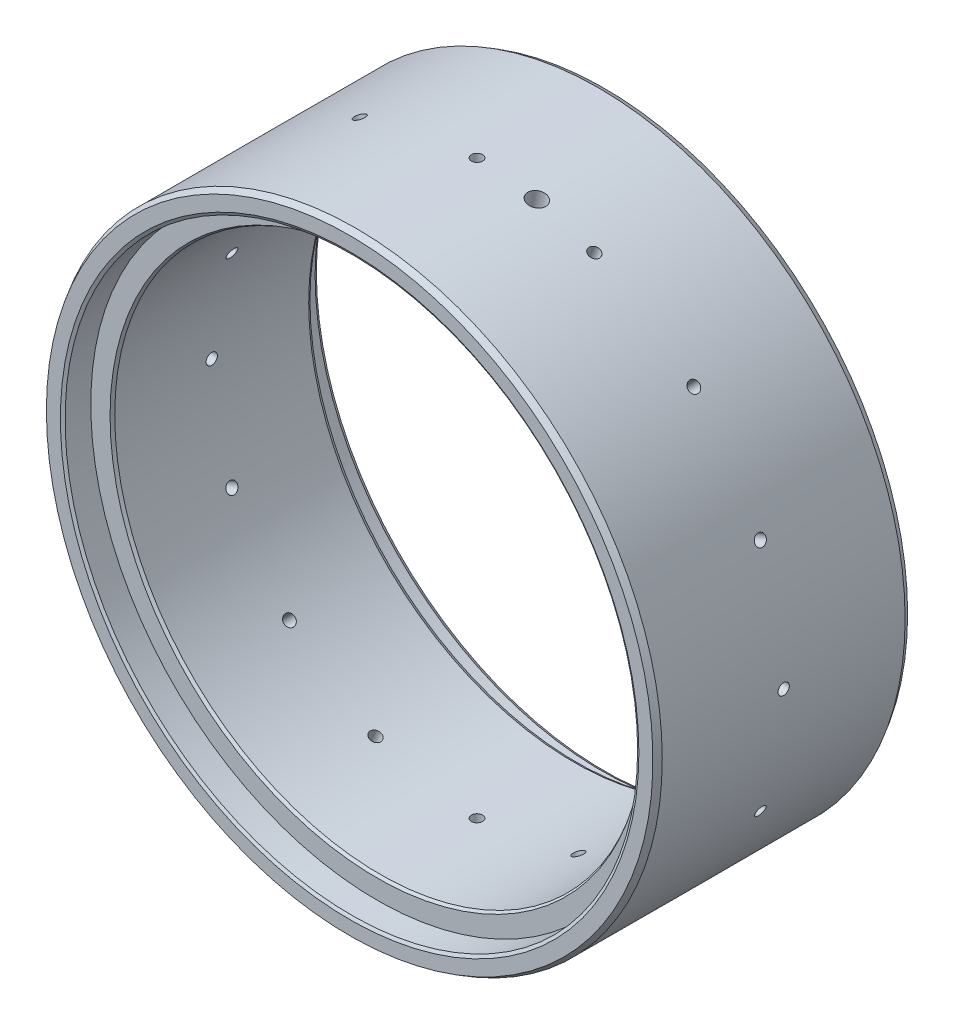
from build123d import *
from OCP.BRepFilletAPI import BRepFilletAPI_MakeChamfer

# Parameters (mm, degrees)
SKETCH1_R                  = 68.199
SKETCH1_R_2                = 58.9915
EXTRUDE1_DEPTH             = 28.321
SKETCH11_R                 = 63.66002
EXTRUDE2_DEPTH             = 6.096
CIRPATTERN1_COUNT          = 16
CHAMFER1_SIZE              = 0.381
CHAMFER1_SIZE2             = 0.659911358
CHAMFER3_SIZE              = 0.762
CHAMFER3_SIZE2             = 1.319822715
F_10_32_TAPPED_HOLE1_D     = 4.0386
F_10_32_TAPPED_HOLE1_DEPTH = 13.6144
F_10_32_TAPPED_HOLE1_TIP   = 1.213317848


with BuildPart() as part:
    # Sketch1 → Extrude1 (new, symmetric)
    with BuildSketch(Plane.XY):
        Circle(SKETCH1_R)
        Circle(SKETCH1_R_2, mode=Mode.SUBTRACT)
    extrude(amount=EXTRUDE1_DEPTH, both=True)

    # Sketch11 → Extrude2 (cut)
    with BuildSketch(Plane(origin=(0, 0, -28.321), x_dir=(-1, 0, 0), z_dir=(0, 0, -1))):
        Circle(SKETCH11_R)
    extrude2 = extrude(amount=-EXTRUDE2_DEPTH, mode=Mode.SUBTRACT)

    # Mirror1: Extrude2 across plane
    add(extrude2.mirror(Plane.XY), mode=Mode.SUBTRACT)

    # Sketch4 → Tap Drill for M3x0.5 Tap1 (revolve, cut)
    with BuildSketch(Plane(origin=(0, 68.199, 0), x_dir=(0, 0, 1), z_dir=(1, 0, 0))):
        Polygon((0, 0), (0, 10.911075774), (1.25, 10.16), (1.25, 0), align=None)
    tap_drill_for_m3x0_5_tap1 = revolve(axis=Axis((0, 74.549, 0), (0, -1, 0)), mode=Mode.SUBTRACT)

    # CirPattern1: Tap Drill for M3x0.5 Tap1 ×16 about axis
    cirpattern1_axis = Axis((0, 0, 28.321), (0, 0, -1))
    for i in range(1, CIRPATTERN1_COUNT):
        add(tap_drill_for_m3x0_5_tap1.rotate(cirpattern1_axis, i * 360 / CIRPATTERN1_COUNT), mode=Mode.SUBTRACT)

    # Chamfer1: one chamfer whose edges measure the first distance from different faces: ONE call of the kernel's chamfer builder (chamfer() names one face for all edges)
    chamfer1_edges_1 = [part.edges().sort_by_distance(p)[0] for p in [
        (-58.9915, 0, -22.225),
    ]]
    chamfer1_side_1 = [part.faces().sort_by_distance(p)[0] for p in [
        (61.859442727, 0, -22.225),
    ]]
    chamfer1_edges_2 = [part.edges().sort_by_distance(p)[0] for p in [
        (63.66002, 0, -28.321),
    ]]
    chamfer1_side_2 = [part.faces().sort_by_distance(p)[0] for p in [
        (-66.270040985, 0, -28.321),
    ]]
    chamfer1_edges_3 = [part.edges().sort_by_distance(p)[0] for p in [
        (63.66002, 0, 28.321),
    ]]
    chamfer1_side_3 = [part.faces().sort_by_distance(p)[0] for p in [
        (63.66002, 0, 25.273),
    ]]
    chamfer1_edges_4 = [part.edges().sort_by_distance(p)[0] for p in [
        (-58.9915, 0, 22.225),
    ]]
    chamfer1_side_4 = [part.faces().sort_by_distance(p)[0] for p in [
        (61.859442727, 0, 22.225),
    ]]
    chamfer1 = BRepFilletAPI_MakeChamfer(part.part.solid().wrapped)
    for e in chamfer1_edges_1:
        chamfer1.Add(CHAMFER1_SIZE, CHAMFER1_SIZE2, e.wrapped, chamfer1_side_1[0].wrapped)  # the first distance lies on this face
    for e in chamfer1_edges_2:
        chamfer1.Add(CHAMFER1_SIZE, CHAMFER1_SIZE2, e.wrapped, chamfer1_side_2[0].wrapped)  # the first distance lies on this face
    for e in chamfer1_edges_3:
        chamfer1.Add(CHAMFER1_SIZE, CHAMFER1_SIZE2, e.wrapped, chamfer1_side_3[0].wrapped)  # the first distance lies on this face
    for e in chamfer1_edges_4:
        chamfer1.Add(CHAMFER1_SIZE, CHAMFER1_SIZE2, e.wrapped, chamfer1_side_4[0].wrapped)  # the first distance lies on this face
    add(Compound.cast(chamfer1.Shape()), mode=Mode.REPLACE)

    # Chamfer3: one chamfer whose edges measure the first distance from different faces: ONE call of the kernel's chamfer builder (chamfer() names one face for all edges)
    chamfer3_edges_1 = [part.edges().sort_by_distance(p)[0] for p in [
        (-68.199, 0, -28.321),
    ]]
    chamfer3_side_1 = [part.faces().sort_by_distance(p)[0] for p in [
        (65.969979015, 0, -28.321),
    ]]
    chamfer3_edges_2 = [part.edges().sort_by_distance(p)[0] for p in [
        (-68.199, 0, 28.321),
    ]]
    chamfer3_side_2 = [part.faces().sort_by_distance(p)[0] for p in [
        (66.248890372, 0, 28.321),
    ]]
    chamfer3 = BRepFilletAPI_MakeChamfer(part.part.solid().wrapped)
    for e in chamfer3_edges_1:
        chamfer3.Add(CHAMFER3_SIZE, CHAMFER3_SIZE2, e.wrapped, chamfer3_side_1[0].wrapped)  # the first distance lies on this face
    for e in chamfer3_edges_2:
        chamfer3.Add(CHAMFER3_SIZE, CHAMFER3_SIZE2, e.wrapped, chamfer3_side_2[0].wrapped)  # the first distance lies on this face
    add(Compound.cast(chamfer3.Shape()), mode=Mode.REPLACE)

    # #10-32 Tapped Hole1
    with Locations(Plane(origin=(13.304964871, 66.888575338, 0), x_dir=(-0.9807852804032304, 0.19509032201612883, 0), z_dir=(0.19509032201612883, 0.9807852804032304, 0))):
        with Locations((0, 0)):
            Hole(F_10_32_TAPPED_HOLE1_D / 2, depth=F_10_32_TAPPED_HOLE1_DEPTH)
            with Locations((0, 0, -(F_10_32_TAPPED_HOLE1_DEPTH + F_10_32_TAPPED_HOLE1_TIP / 2))):  # 118° drill point
                Cone(0, F_10_32_TAPPED_HOLE1_D / 2, F_10_32_TAPPED_HOLE1_TIP, mode=Mode.SUBTRACT)


solid = part.part
